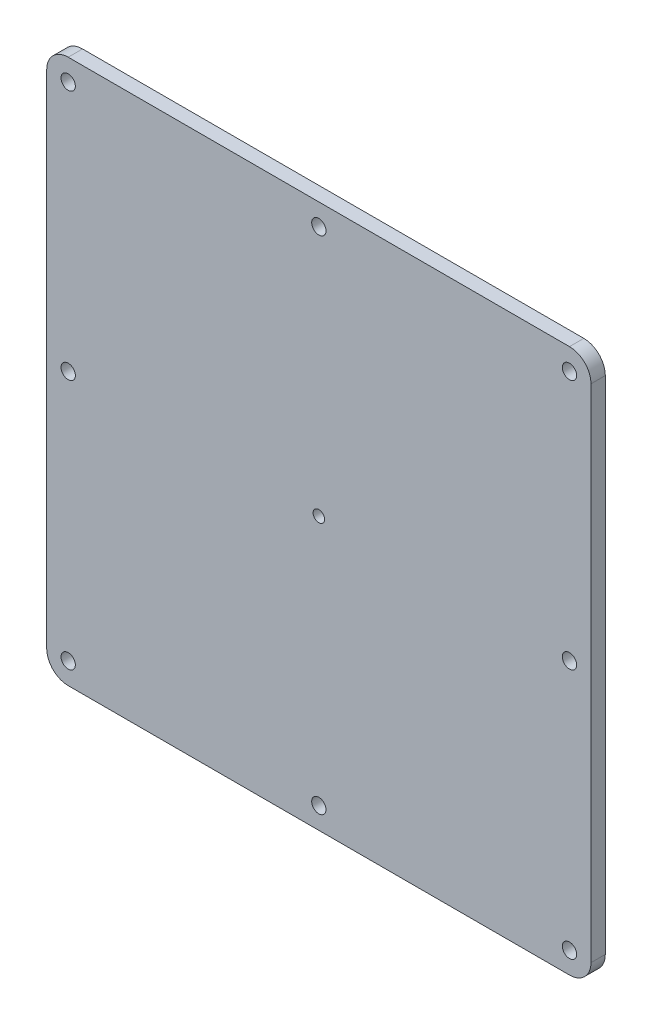
from build123d import *

# Parameters (mm, degrees)
SKETCH2_R           = 5
SKETCH2_R_2         = 4
BOSS_EXTRUDE1_DEPTH = 10


with BuildPart() as part:
    # Sketch2 → Boss-Extrude1 (new body)
    with BuildSketch(Plane.XY):
        with BuildLine():
            Line((-175, 190), (175, 190))
            ThreePointArc((175, 190), (185.606601718, 185.606601718), (190, 175))
            Line((190, 175), (190, -175))
            ThreePointArc((190, -175), (185.606601718, -185.606601718), (175, -190))
            Line((175, -190), (-175, -190))
            ThreePointArc((-175, -190), (-185.606601718, -185.606601718), (-190, -175))
            Line((-190, -175), (-190, 175))
            ThreePointArc((-190, 175), (-185.606601718, 185.606601718), (-175, 190))
        make_face()
        with Locations((-175, 175)):
            Circle(SKETCH2_R, mode=Mode.SUBTRACT)
        with Locations((0, 175)):
            Circle(SKETCH2_R, mode=Mode.SUBTRACT)
        with Locations((175, 175)):
            Circle(SKETCH2_R, mode=Mode.SUBTRACT)
        with Locations((175, 0)):
            Circle(SKETCH2_R, mode=Mode.SUBTRACT)
        with Locations((-175, 0)):
            Circle(SKETCH2_R, mode=Mode.SUBTRACT)
        with Locations((-175, -175)):
            Circle(SKETCH2_R, mode=Mode.SUBTRACT)
        with Locations((0, -175)):
            Circle(SKETCH2_R, mode=Mode.SUBTRACT)
        with Locations((175, -175)):
            Circle(SKETCH2_R, mode=Mode.SUBTRACT)
        Circle(SKETCH2_R_2, mode=Mode.SUBTRACT)
    extrude(amount=BOSS_EXTRUDE1_DEPTH)


solid = part.part
